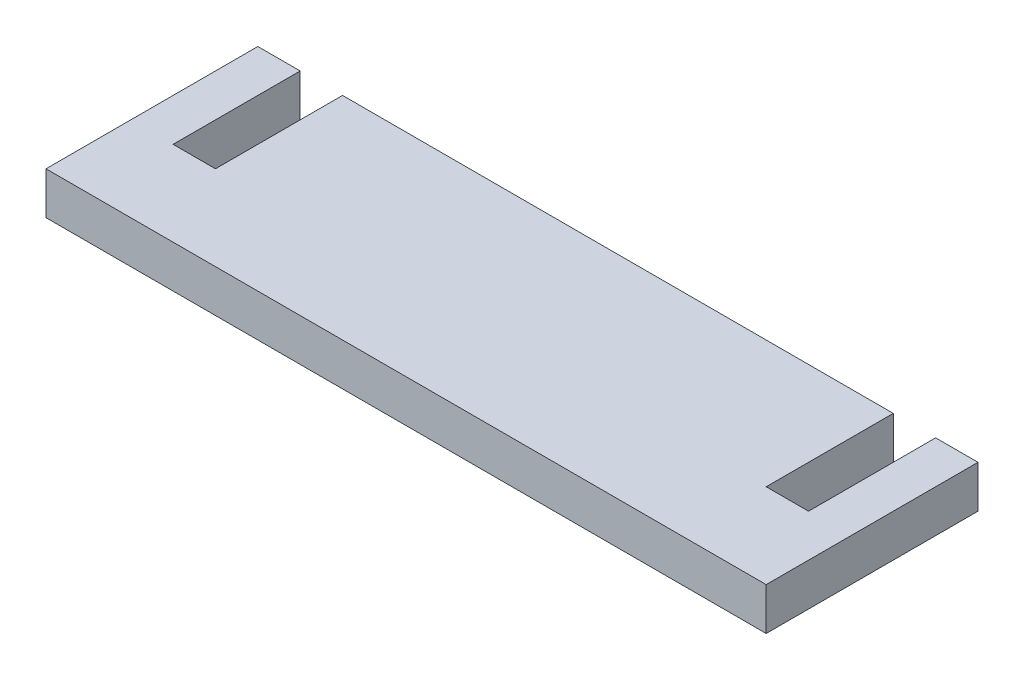
from build123d import *

# Parameters (mm, degrees)
BOSS_EXTRUDE1_DEPTH = 254


with BuildPart() as part:
    # Sketch1 → Boss-Extrude1 (new body)
    with BuildSketch(Plane(origin=(0, 0, 0), x_dir=(1, 0, 0), z_dir=(0, 1, 0))):
        Polygon((0, 0), (-4318, 0), (-4318, 1270), (-4064, 1270), (-4064, 508), (-3810, 508), (-3810, 1270), (-508, 1270), (-508, 508), (-254, 508), (-254, 1270), (0, 1270), align=None)
    extrude(amount=BOSS_EXTRUDE1_DEPTH)


solid = part.part
